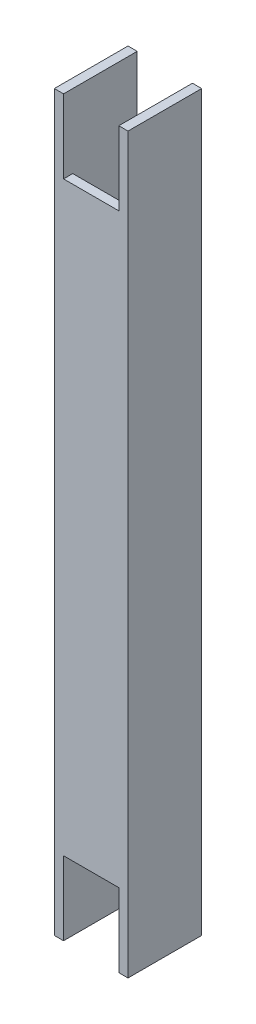
from build123d import *

# Parameters (mm, degrees)
EXTRUDE_THIN1_DEPTH = 252.9
SKETCH2_W           = 19.05
SKETCH2_H           = 25.4
CUT_EXTRUDE1_DEPTH  = 3.175


with BuildPart() as part:
    # Sketch1 → Extrude-Thin1 (new body)
    with BuildSketch(Plane(origin=(0, 0, 0), x_dir=(1, 0, 0), z_dir=(0, 1, 0))):
        Polygon((0, 25.4), (0, 0), (25.4, 0), (25.4, 25.4), (22.225, 25.4), (22.225, 3.175), (3.175, 3.175), (3.175, 25.4), align=None)
    extrude(amount=EXTRUDE_THIN1_DEPTH)

    # Sketch2 → Cut-Extrude1 (cut)
    with BuildSketch(Plane(origin=(0, 0, -3.175), x_dir=(-1, 0, 0), z_dir=(0, 0, -1))):
        with Locations((-12.7, 12.7)):
            Rectangle(SKETCH2_W, SKETCH2_H)
        with Locations((-12.7, 240.2)):
            Rectangle(SKETCH2_W, SKETCH2_H)
    extrude(amount=-CUT_EXTRUDE1_DEPTH, mode=Mode.SUBTRACT)


solid = part.part
